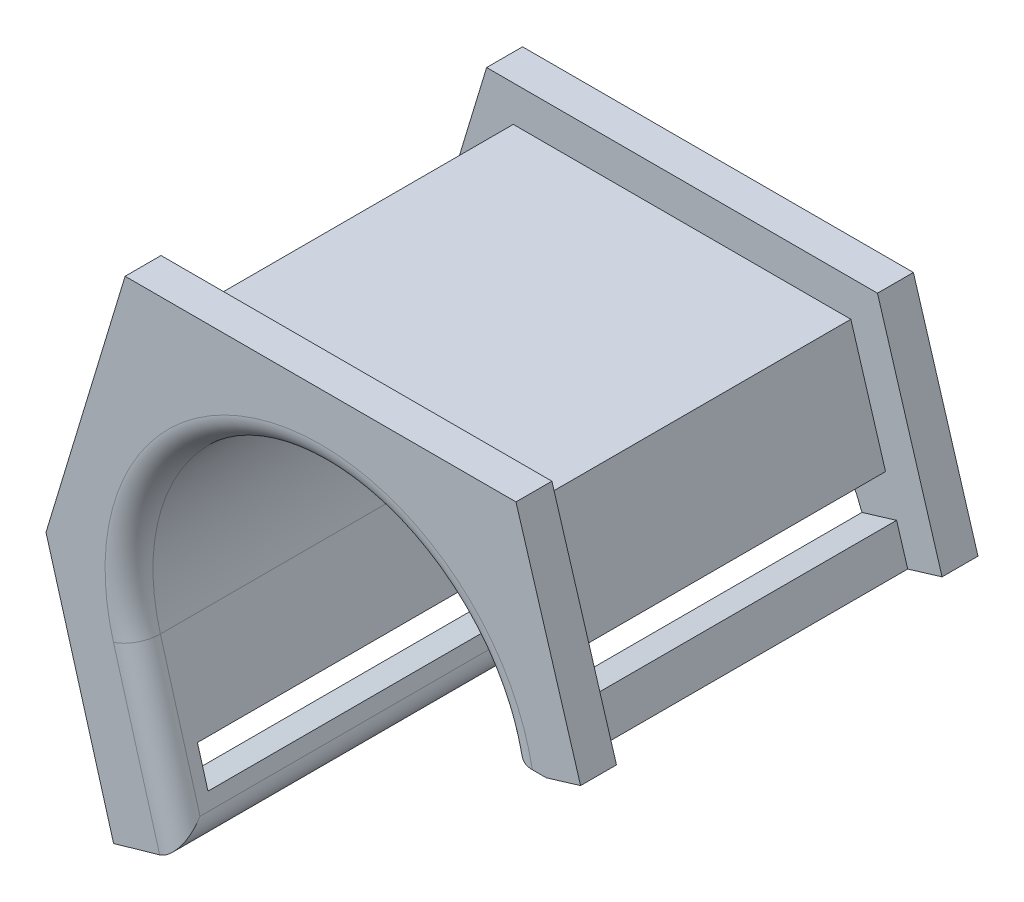
from build123d import *

# Parameters (mm, degrees)
BOSS_EXTRUDE1_DEPTH     = 16.6
BOSS_EXTRUDE2_DEPTH     = 16.6
CUT_EXTRUDE1_START      = 1.5
CUT_EXTRUDE1_DEPTH      = 13.6
CUT_EXTRUDE2_REACH      = 31.238
CUT_EXTRUDE2_END_RADIUS = 8
SKETCH3_W               = 13.6
SKETCH3_H               = 1.6
SKETCH4_W               = 13.6
SKETCH4_H               = 1.6
CUT_EXTRUDE3_DEPTH      = 1.5
FILLET1_R               = 1


with BuildPart() as part:
    # Sketch1 → Boss-Extrude1 (new body)
    with BuildSketch(Plane.XY):
        with BuildLine():
            Line((7.05, 9.5), (-7.05, 9.5))
            Line((-7.05, 9.5), (-9.903774495, 0.072462085))
            Line((-9.903774495, 0.072462085), (-7.202037804, -9.347761843))
            Line((-7.202037804, -9.347761843), (-5.760166795, -8.934230717))
            Line((-5.760166795, -8.934230717), (-7.689978717, -2.205499339))
            ThreePointArc((-7.689978717, -2.205499339), (-1.929824659, 7.763747599), (7.82763731, 1.651694325))
            Line((7.82763731, 1.651694325), (9.425731052, 1.651694325))
            Line((9.425731052, 1.651694325), (7.05, 9.5))
        make_face()
    extrude(amount=BOSS_EXTRUDE1_DEPTH)

    # Sketch2 → Boss-Extrude2 (add)
    with BuildSketch(Plane.XY):
        Polygon((-9.903774495, 0.072462085), (-7.202037804, -9.347761843), (-8.643908814, -9.761292969), (-11.467528363, 0.083903467), (-8.163157895, 11), (8.163157895, 11), (10.861396724, 2.086279273), (9.425731052, 1.651694325), (7.05, 9.5), (-7.05, 9.5), align=None)
    extrude(amount=BOSS_EXTRUDE2_DEPTH)

    # Sketch2<4> → Cut-Extrude1 (cut)
    with BuildSketch(Plane.XY.offset(CUT_EXTRUDE1_START)):
        Polygon((-9.903774495, 0.072462085), (-7.202037804, -9.347761843), (-8.643908814, -9.761292969), (-11.467528363, 0.083903467), (-8.163157895, 11), (8.163157895, 11), (10.861396724, 2.086279273), (9.425731052, 1.651694325), (7.05, 9.5), (-7.05, 9.5), align=None)
    extrude(amount=CUT_EXTRUDE1_DEPTH, mode=Mode.SUBTRACT)

    # Cut-Extrude2: up to this cylinder (the profile starts outside it)
    cut_extrude2_end = Plane(origin=(0, 0, 8.3), z_dir=(0, 0, -1)) * Cylinder(CUT_EXTRUDE2_END_RADIUS, 79.476, mode=Mode.PRIVATE)
    # Sketch3 → Cut-Extrude2 (cut, up to the surface)
    with BuildSketch(Plane(origin=(9.092549258, 2.75237134, 0), x_dir=(0, 0, -1), z_dir=(0.9571104481877781, 0.2897232989764385, 0)), mode=Mode.PRIVATE) as cut_extrude2_sk1:
        with Locations((-8.3, 1.25)):
            Rectangle(SKETCH3_W, SKETCH3_H)
    cut_extrude2_tool1 = extrude(cut_extrude2_sk1.sketch, amount=-CUT_EXTRUDE2_REACH, mode=Mode.PRIVATE) - cut_extrude2_end
    add(cut_extrude2_tool1.solids().sort_by_distance((8.730395, 3.948759, 8.3))[0], mode=Mode.SUBTRACT)

    # Sketch4 → Cut-Extrude3 (cut)
    with BuildSketch(Plane(origin=(-9.131849726, -2.619030466, 0), x_dir=(0, 0, 1), z_dir=(-0.9612473395932443, -0.2756874174221783, 0))):
        with Locations((8.3, -4.6)):
            Rectangle(SKETCH4_W, SKETCH4_H)
    extrude(amount=-CUT_EXTRUDE3_DEPTH, mode=Mode.SUBTRACT)

    # Fillet1
    fillet1_edges = [part.edges().sort_by_distance(p)[0] for p in [
        (7.82763731, 1.651694325, 8.3),
        (-5.760166795, -8.934230717, 8.3),
        (-6.725072756, -5.569865028, 16.6),
        (-1.929824659, 7.763747599, 16.6),
        (-1.929824659, 7.763747599, 0),
        (-6.725072756, -5.569865028, 0),
    ]]
    fillet(fillet1_edges, radius=FILLET1_R)


solid = part.part
